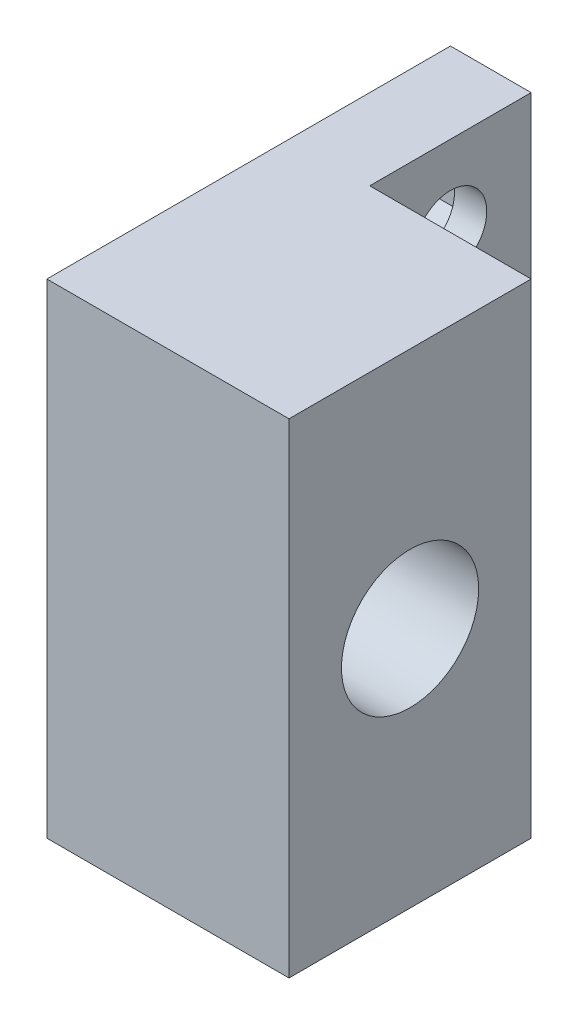
from build123d import *

# Parameters (mm, degrees)
BOSS_EXTRUDE1_DEPTH = 5
SKETCH2_W           = 15
SKETCH2_H           = 30
BOSS_EXTRUDE2_DEPTH = 10
SKETCH3_R           = 4.25
CUT_EXTRUDE1_DEPTH  = 15
SKETCH4_R           = 2.25
CUT_EXTRUDE2_DEPTH  = 15
CUT_EXTRUDE3_DEPTH  = 3


with BuildPart() as part:
    # Sketch1 → Boss-Extrude1 (new body)
    with BuildSketch(Plane(origin=(0, 0, 0), x_dir=(0, 0, -1), z_dir=(1, 0, 0))):
        Polygon((25, 0), (25, 10), (15, 10), (15, 20), (25, 20), (25, 30), (0, 30), (0, 0), align=None)
    extrude(amount=BOSS_EXTRUDE1_DEPTH)

    # Sketch2 → Boss-Extrude2 (add)
    with BuildSketch(Plane(origin=(5, 0, 0), x_dir=(0, 0, -1), z_dir=(1, 0, 0))):
        with Locations((7.5, 15)):
            Rectangle(SKETCH2_W, SKETCH2_H)
    extrude(amount=BOSS_EXTRUDE2_DEPTH)

    # Sketch3 → Cut-Extrude1 (cut)
    with BuildSketch(Plane(origin=(15, 0, 0), x_dir=(0, 0, -1), z_dir=(1, 0, 0))):
        with Locations((7.5, 15)):
            Circle(SKETCH3_R)
    extrude(amount=-CUT_EXTRUDE1_DEPTH, mode=Mode.SUBTRACT)

    # Sketch4 → Cut-Extrude2 (cut)
    with BuildSketch(Plane(origin=(5, 0, 0), x_dir=(0, 0, -1), z_dir=(1, 0, 0))):
        with Locations((20, 25)):
            Circle(SKETCH4_R)
        with Locations((20, 5)):
            Circle(SKETCH4_R)
    extrude(amount=-CUT_EXTRUDE2_DEPTH, mode=Mode.SUBTRACT)

    # Sketch5 → Cut-Extrude3 (cut)
    with BuildSketch(Plane.ZY):
        Polygon((-20, 29), (-23.464101615, 27), (-23.464101615, 23), (-20, 21), (-16.535898385, 23), (-16.535898385, 27), align=None)
        Polygon((-20, 9), (-23.464101615, 7), (-23.464101615, 3), (-20, 1), (-16.535898385, 3), (-16.535898385, 7), align=None)
    extrude(amount=-CUT_EXTRUDE3_DEPTH, mode=Mode.SUBTRACT)


solid = part.part
